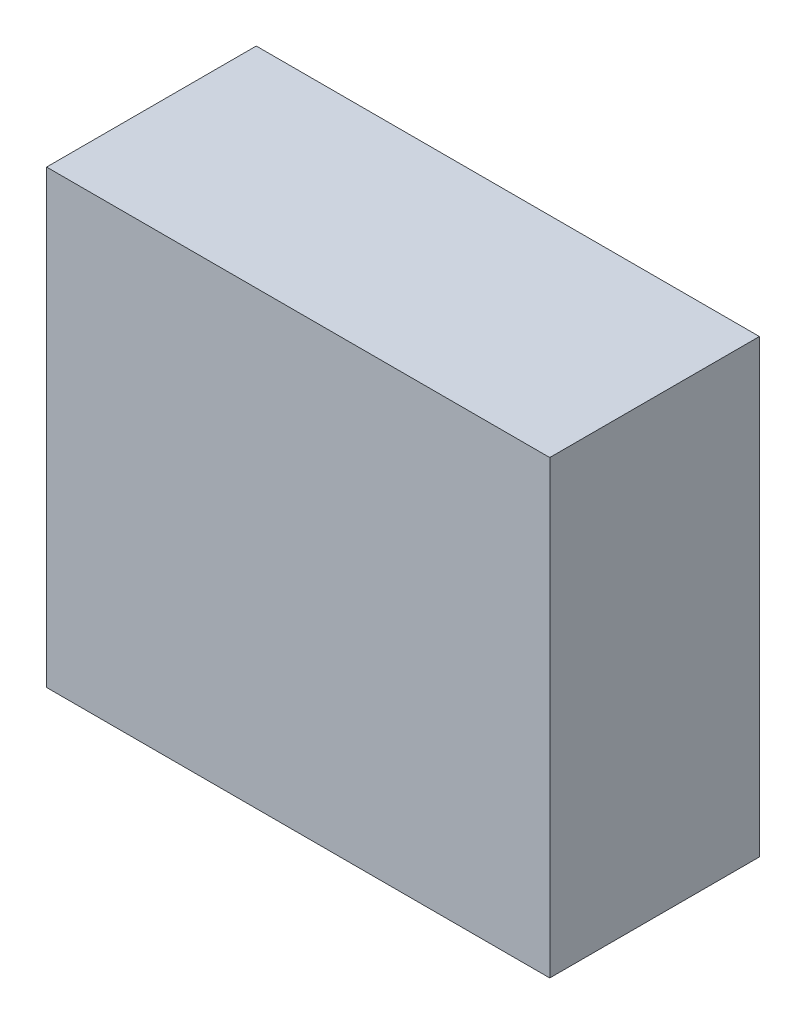
from build123d import *

# Parameters (mm, degrees)
SKETCH1_W           = 480
SKETCH1_H           = 200
BOSS_EXTRUDE1_DEPTH = 430


with BuildPart() as part:
    # Sketch1 → Boss-Extrude1 (new body)
    with BuildSketch(Plane(origin=(0, 0, 0), x_dir=(1, 0, 0), z_dir=(0, 1, 0))):
        Rectangle(SKETCH1_W, SKETCH1_H)
    extrude(amount=BOSS_EXTRUDE1_DEPTH)


solid = part.part
